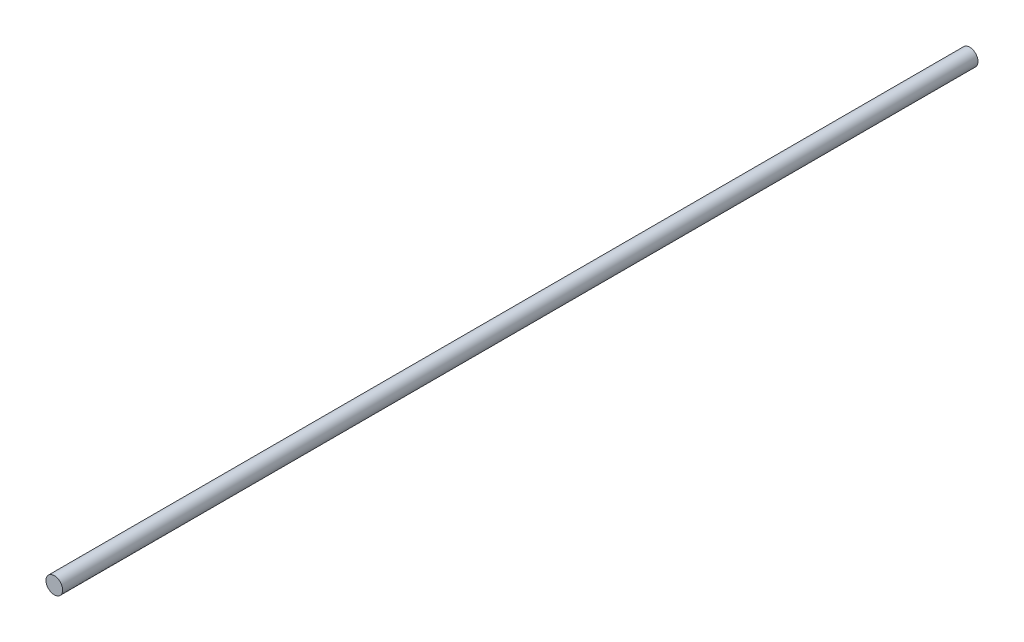
from build123d import *

# Parameters (mm, degrees)
SKETCH1_R           = 5
BOSS_EXTRUDE1_DEPTH = 550


with BuildPart() as part:
    # Sketch1 → Boss-Extrude1 (new body)
    with BuildSketch(Plane.XY):
        Circle(SKETCH1_R)
    extrude(amount=BOSS_EXTRUDE1_DEPTH)


solid = part.part
